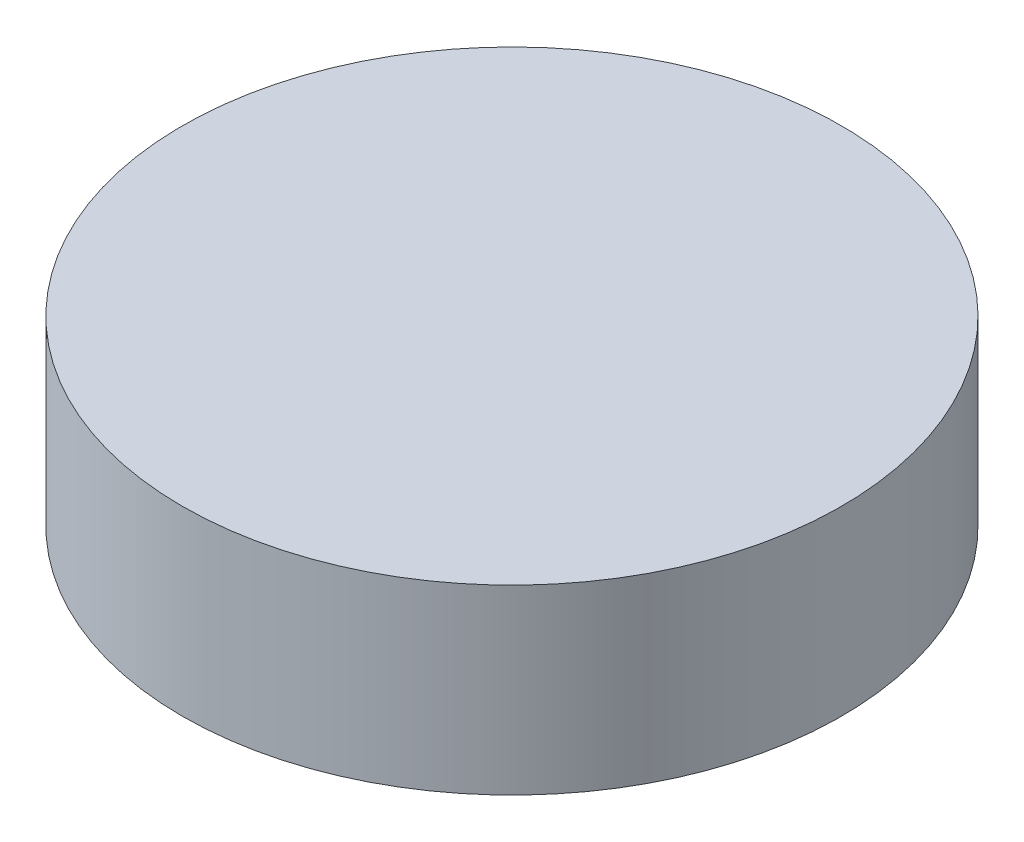
from build123d import *

# Parameters (mm, degrees)
SKETCH1_R           = 36.83
BOSS_EXTRUDE1_DEPTH = 20.32


with BuildPart() as part:
    # Sketch1 → Boss-Extrude1 (new body)
    with BuildSketch(Plane(origin=(0, 0, 0), x_dir=(1, 0, 0), z_dir=(0, 1, 0))):
        with Locations(Location((-1.359065717, 0.51587322, 0), (0, 0, 270))):
            Circle(SKETCH1_R)
    extrude(amount=BOSS_EXTRUDE1_DEPTH)


solid = part.part
